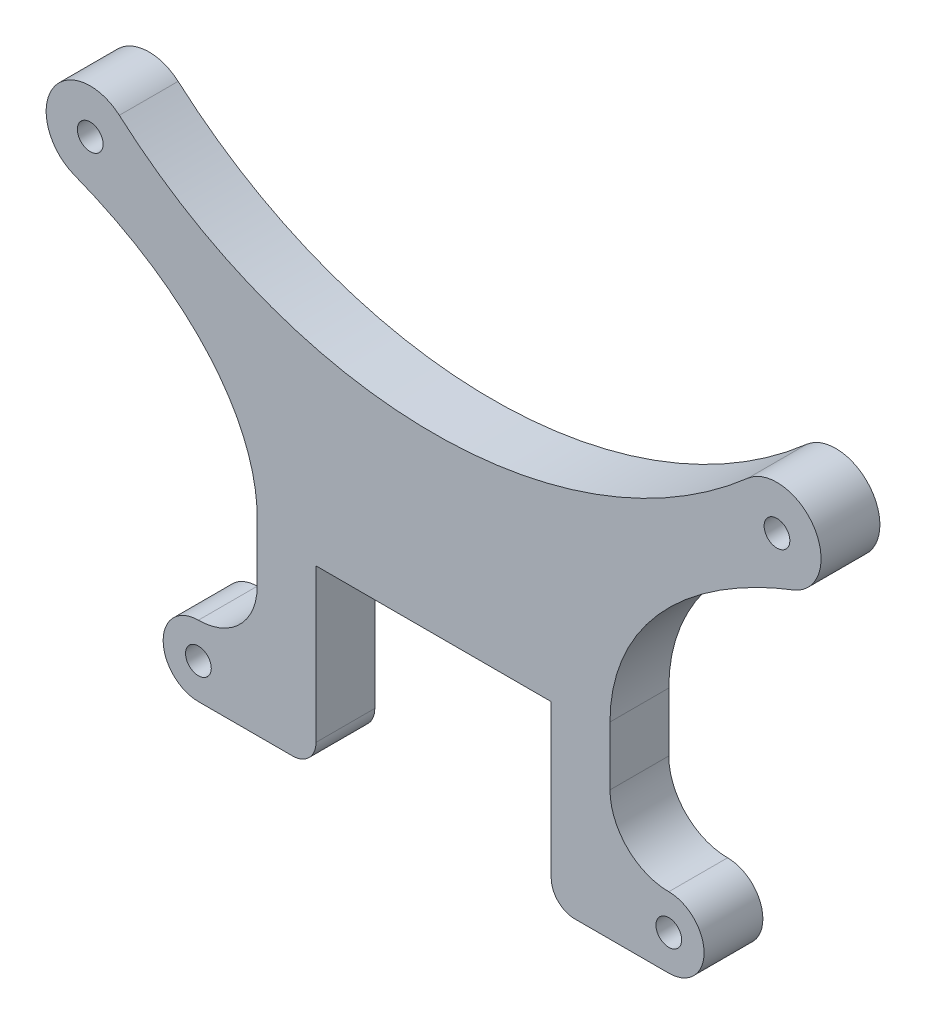
from build123d import *

# Parameters (mm, degrees)
SKETCH1_R           = 1.3890625
BOSS_EXTRUDE1_DEPTH = 6.35


with BuildPart() as part:
    # Sketch1 → Boss-Extrude1 (new body)
    with BuildSketch(Plane.XY):
        with BuildLine():
            Line((12.7, 0), (-12.7, 0))
            Line((-12.7, 0), (-12.7, -16.51))
            ThreePointArc((-12.7, -16.51), (-13.443948776, -18.306051224), (-15.24, -19.05))
            Line((-15.24, -19.05), (-25.4, -19.05))
            ThreePointArc((-25.4, -19.05), (-29.21, -15.24), (-25.4, -11.43))
            ThreePointArc((-25.4, -11.43), (-20.909871939, -9.570128061), (-19.05, -5.08))
            Line((-19.05, -5.08), (-19.05, 1.27))
            add(Edge.make_bspline(
                [(-19.05, 1.27), (-19.05, 15.828620542), (-38.807847876, 23.500433408)],
                knots=[0, 0, 0, 1.015776501, 1.015776501, 1.015776501], degree=2, weights=[1, 0.873773469, 1]))
            ThreePointArc((-38.807847876, 23.500433408), (-41.155413928, 30.410828457), (-33.941740139, 31.518771801))
            ThreePointArc((-33.941740139, 31.518771801), (0, 18.732499831), (33.941740139, 31.518771801))
            ThreePointArc((33.941740139, 31.518771801), (41.155413928, 30.410828457), (38.807847876, 23.500433408))
            add(Edge.make_bspline(
                [(38.807847876, 23.500433408), (19.05, 15.828620542), (19.05, 1.27)],
                knots=[2.125816153, 2.125816153, 2.125816153, 3.141592654, 3.141592654, 3.141592654], degree=2, weights=[1, 0.873773469, 1]))
            Line((19.05, 1.27), (19.05, -5.08))
            ThreePointArc((19.05, -5.08), (20.909871939, -9.570128061), (25.4, -11.43))
            ThreePointArc((25.4, -11.43), (29.21, -15.24), (25.4, -19.05))
            Line((25.4, -19.05), (15.24, -19.05))
            ThreePointArc((15.24, -19.05), (13.443948776, -18.306051224), (12.7, -16.51))
            Line((12.7, -16.51), (12.7, 0))
        make_face()
        with Locations((-37.084, 27.94)):
            Circle(SKETCH1_R, mode=Mode.SUBTRACT)
        with Locations((-25.4, -15.24)):
            Circle(SKETCH1_R, mode=Mode.SUBTRACT)
        with Locations(Location((25.4, -15.24, 0), (0, 0, 180))):
            Circle(SKETCH1_R, mode=Mode.SUBTRACT)
        with Locations(Location((37.084, 27.94, 0), (0, 0, 180))):
            Circle(SKETCH1_R, mode=Mode.SUBTRACT)
    extrude(amount=BOSS_EXTRUDE1_DEPTH)


solid = part.part
